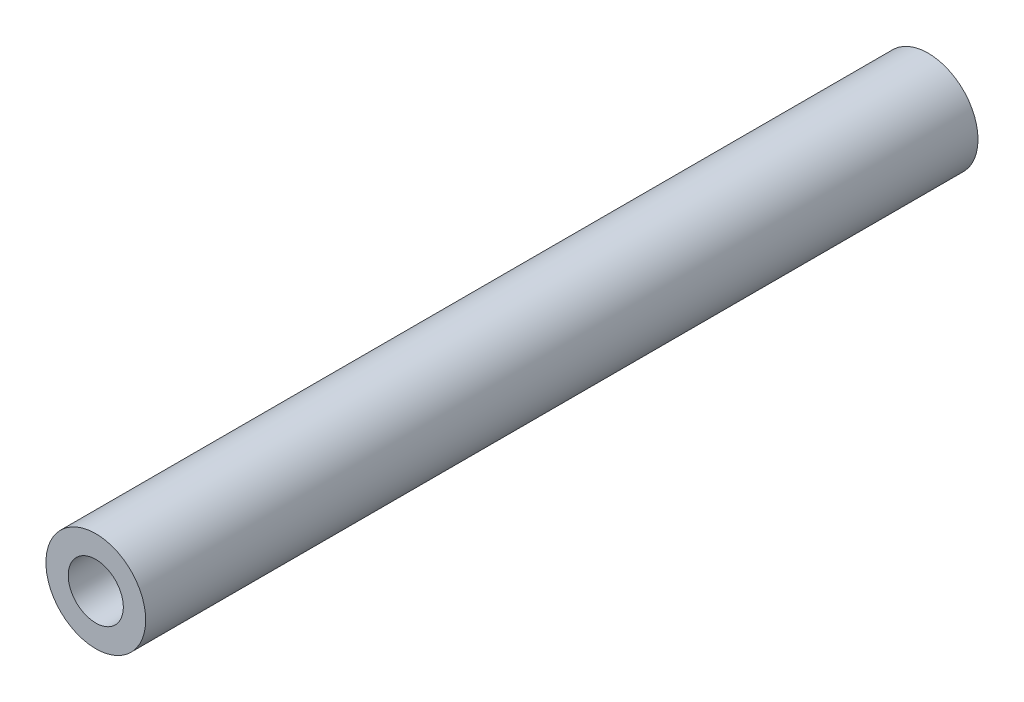
from build123d import *

# Parameters (mm, degrees)
SCHIZZO1_R                   = 2.985
ESTRUSIONE_ESTRUSIONE1_DEPTH = 24.91
SCHIZZO2_R                   = 1.6
TAGLIO_ESTRUSIONE1_DEPTH     = 50.998528478


with BuildPart() as part:
    # Schizzo1 → Estrusione-Estrusione1 (new, symmetric)
    with BuildSketch(Plane.XY):
        Circle(SCHIZZO1_R)
    extrude(amount=ESTRUSIONE_ESTRUSIONE1_DEPTH, both=True)

    # Schizzo2 → Taglio-Estrusione1 (cut, through all)
    with BuildSketch(Plane.XY.offset(24.91)):
        Circle(SCHIZZO2_R)
    extrude(amount=-TAGLIO_ESTRUSIONE1_DEPTH, mode=Mode.SUBTRACT)

    # Schizzo3 → Foro filettato M4x0.7-1 (revolve, cut)
    with BuildSketch(Plane(origin=(0, 0, 24.91), x_dir=(0, -1, 0), z_dir=(1, 0, 0))):
        Polygon((0, 0), (0, 12.991420021), (1.65, 12), (1.65, 0), align=None)
    foro_filettato_m4x0_7_1 = revolve(axis=Axis((0, 0, 31.26), (0, 0, -1)), mode=Mode.SUBTRACT)

    # Specchia1: Foro filettato M4x0.7-1 across plane
    add(foro_filettato_m4x0_7_1.mirror(Plane.XY), mode=Mode.SUBTRACT)


solid = part.part
